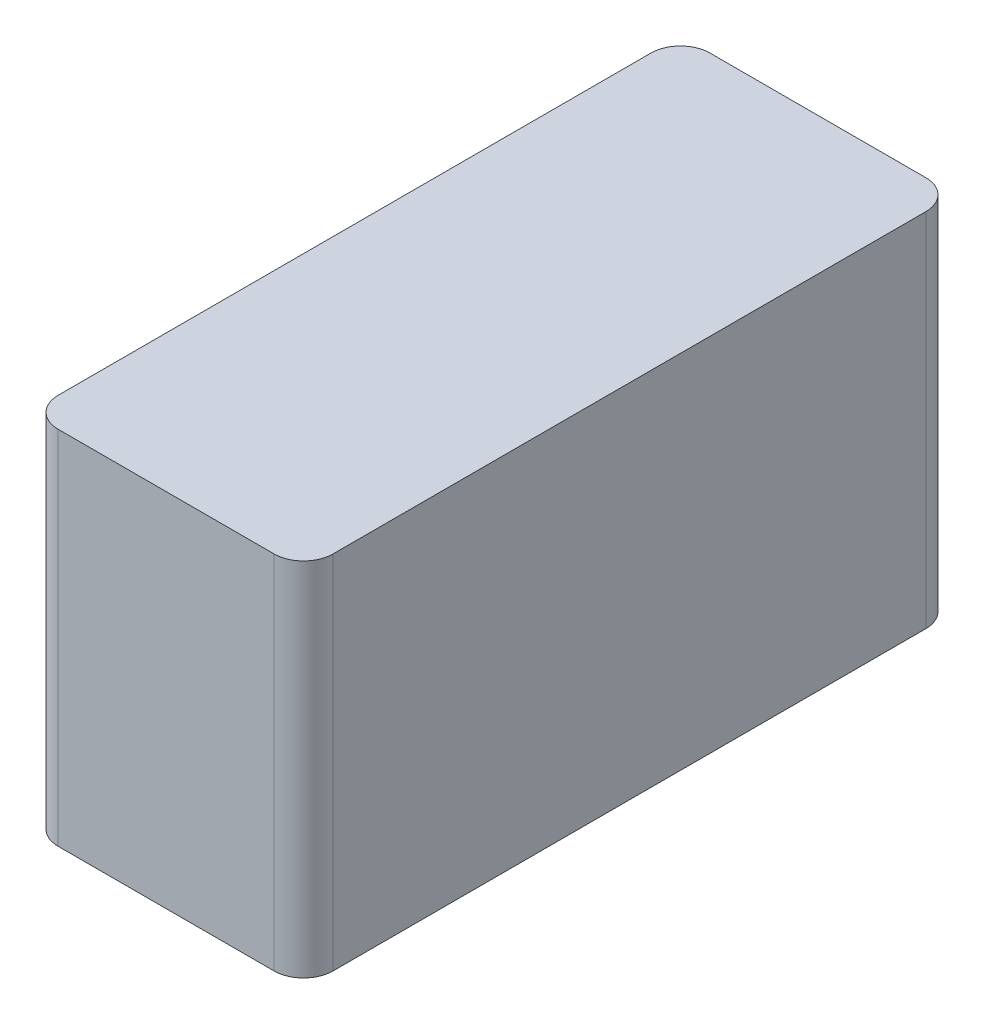
from build123d import *

# Parameters (mm, degrees)
SKETCH_1_W      = 332
SKETCH_1_H      = 184
EXTRUDE_1_DEPTH = 140
FILLET_1_R      = 15


with BuildPart() as part:
    # 草图1 → 凸台-拉伸1 (new body)
    with BuildSketch(Plane(origin=(0, 0, 0), x_dir=(0, 0, -1), z_dir=(1, 0, 0))):
        with Locations((166, -92)):
            Rectangle(SKETCH_1_W, SKETCH_1_H)
    extrude(amount=EXTRUDE_1_DEPTH)

    # 圆角1
    fillet_1_edges = [part.edges().sort_by_distance(p)[0] for p in [
        (140, -92, -332),
        (140, -92, 0),
        (0, -92, -332),
        (0, -92, 0),
    ]]
    fillet(fillet_1_edges, radius=FILLET_1_R)


solid = part.part
